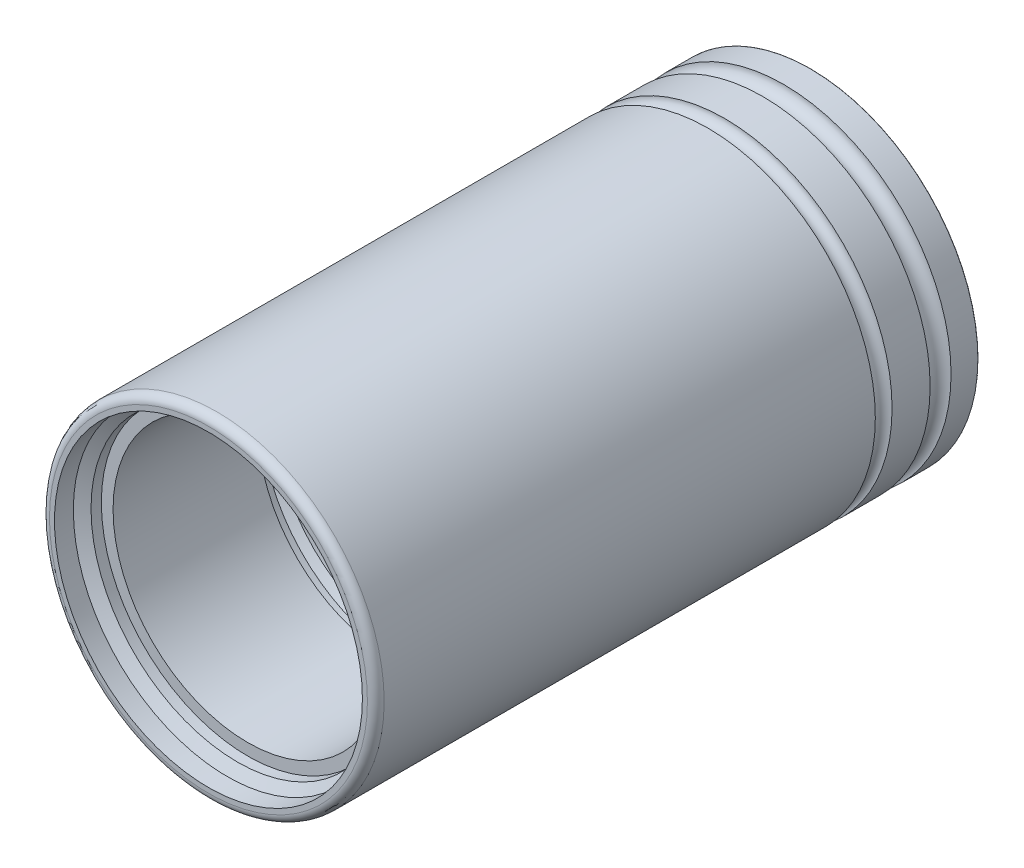
from build123d import *

# Parameters (mm, degrees)
SKETCH_1_R          = 20
EXTRUDE_1_DEPTH     = 72
FILLET_2_R          = 1
SKETCH_6_R          = 18.4
CUT_EXTRUDE_1_DEPTH = 2.6
FILLET_3_R          = 0.05
SKETCH_8_R          = 1.25
SKETCH_8_R_2        = 1


with BuildPart() as part:
    # Эскиз1 → Бобышка-Вытянуть1 (new body)
    with BuildSketch(Plane.XY):
        Circle(SKETCH_1_R)
    extrude(amount=-EXTRUDE_1_DEPTH)

    # Эскиз4 → Вырез-Повернуть1 (revolve, cut)
    with BuildSketch(Plane(origin=(0, 0, 0), x_dir=(0, 0, -1), z_dir=(1, 0, 0)), mode=Mode.PRIVATE) as cut_revolve_1_sk:
        with BuildLine():
            Line((0, 0), (0, 17.5))
            Line((0, 17.5), (4.7, 17.5))
            Line((4.7, 17.5), (4.7, 16.1))
            Line((4.7, 16.1), (22, 16.1))
            Line((22, 16.1), (22, 17.1))
            Line((22, 17.1), (23.4, 17.1))
            Line((23.4, 17.1), (23.977350269, 16.1))
            Line((23.977350269, 16.1), (30.3, 16.1))
            Line((30.3, 16.1), (30.3, 18))
            Line((30.3, 18), (33.5, 18))
            Line((33.5, 18), (33.5, 16.1))
            Line((33.5, 16.1), (47, 16.1))
            Line((47, 16.1), (47, 6))
            Line((47, 6), (49, 6))
            Line((49, 6), (49, 9.5))
            Line((49, 9.5), (52.8, 9.5))
            ThreePointArc((52.8, 9.5), (53.4, 10.1), (54, 9.5))
            Line((54, 9.5), (55.5, 9.5))
            Line((55.5, 9.5), (55.5, 10.75))
            Line((55.5, 10.75), (67, 10.75))
            Line((67, 10.75), (67, 12.4))
            Line((67, 12.4), (70, 12.4))
            Line((70, 12.4), (70, 10.75))
            Line((70, 10.75), (72, 10.75))
            Line((72, 10.75), (72, 0))
            Line((72, 0), (0, 0))
        make_face()
    revolve(cut_revolve_1_sk.sketch.rotate(Axis((0, 0, -72), (0, 0, 1)), 90), axis=Axis((0, 0, -72), (0, 0, 1)), mode=Mode.SUBTRACT)

    # Эскиз5 → Вырез-Повернуть2 (revolve, cut)
    with BuildSketch(Plane(origin=(0, 0, 0), x_dir=(0, 0, -1), z_dir=(1, 0, 0)), mode=Mode.PRIVATE) as cut_revolve_2_sk:
        Polygon((3.466025404, 17.5), (1.733974596, 17.5), (2.6, 19), align=None)
    revolve(cut_revolve_2_sk.sketch.rotate(Axis((0, 0, 0), (0, 0, -1)), 270), axis=Axis((0, 0, 0), (0, 0, -1)), mode=Mode.SUBTRACT)

    # Скругление2
    fillet_2_edges = [part.edges().sort_by_distance(p)[0] for p in [
        (-20, 0, 0),
    ]]
    fillet(fillet_2_edges, radius=FILLET_2_R)

    # Эскиз6 → Вырез-Вытянуть1 (cut)
    with BuildSketch(Plane.XY):
        Circle(SKETCH_6_R)
    extrude(amount=-CUT_EXTRUDE_1_DEPTH, mode=Mode.SUBTRACT)

    # Скругление3
    fillet_3_edges = [part.edges().sort_by_distance(p)[0] for p in [
        (-20, 0, -72),
        (6, 0, -49),
        (10.75, 0, -72),
    ]]
    fillet(fillet_3_edges, radius=FILLET_3_R)

    # Эскиз7 → Повернуть1 (revolve)
    with BuildSketch(Plane(origin=(0, 0, 0), x_dir=(1, 0, 0), z_dir=(0, 1, 0))):
        with BuildLine():
            Line((-14.5, 72), (-15.95, 72))
            Line((-15.95, 72), (-15.95, 72.898350696))
            ThreePointArc((-15.95, 72.898350696), (-15.657106781, 73.605457478), (-14.95, 73.898350696))
            Line((-14.95, 73.898350696), (-14.5, 73.898350696))
            Line((-14.5, 73.898350696), (-14.047588603, 73.898350696))
            ThreePointArc((-14.047588603, 73.898350696), (-13.340481822, 73.605457478), (-13.047588603, 72.898350696))
            Line((-13.047588603, 72.898350696), (-13.047588603, 72))
            Line((-13.047588603, 72), (-14.5, 72))
        make_face()
    revolve(axis=Axis((0, 0, -88.958875933), (0, 0, 1)))

    # Эскиз8 → Вырез-Повернуть3 (revolve, cut)
    with BuildSketch(Plane(origin=(0, 0, 0), x_dir=(0, 0, -1), z_dir=(1, 0, 0)), mode=Mode.PRIVATE) as cut_revolve_3_sk:
        with Locations((67.5, 20)):
            Circle(SKETCH_8_R)
        with Locations((60.7, 20)):
            Circle(SKETCH_8_R_2)
    revolve(cut_revolve_3_sk.sketch.rotate(Axis((0, 0, 0), (0, 0, -1)), 90), axis=Axis((0, 0, 0), (0, 0, -1)), mode=Mode.SUBTRACT)


solid = part.part
